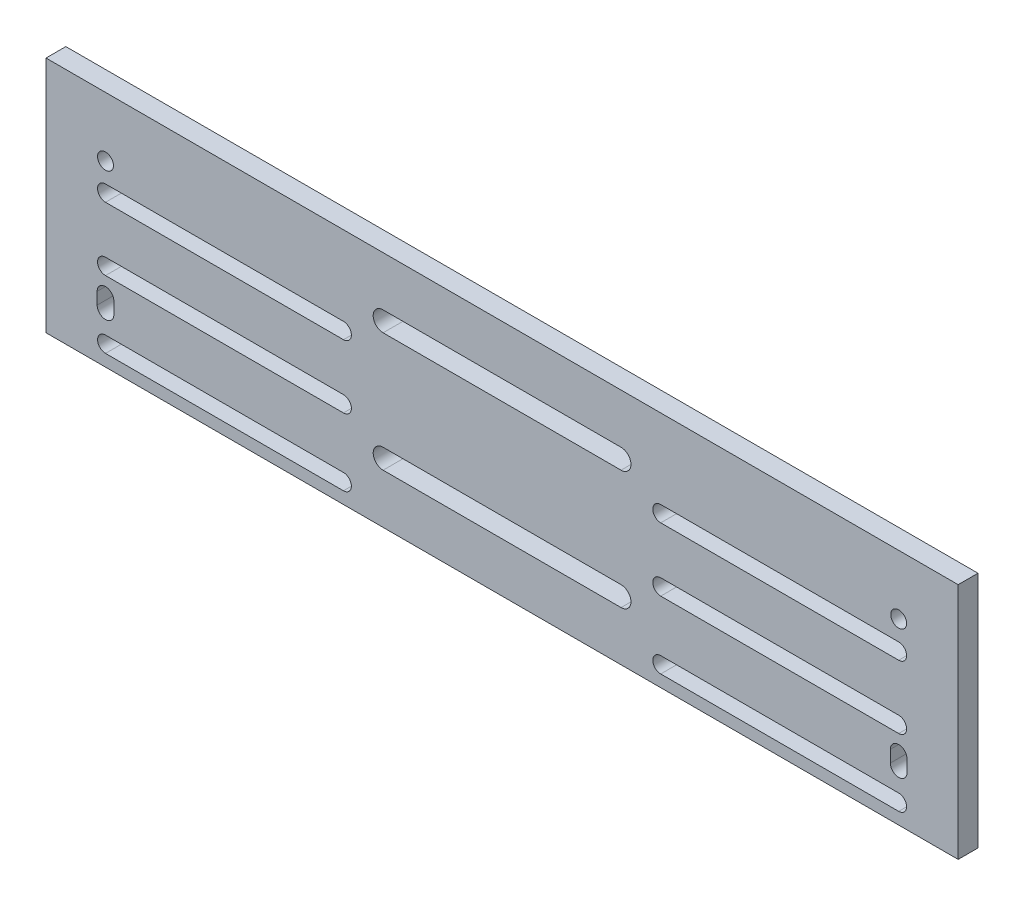
from build123d import *

# Parameters (mm, degrees)
SKETCH_2_W      = 230
SKETCH_2_H      = 60
SKETCH_2_R      = 2
EXTRUDE_1_DEPTH = 5


with BuildPart() as part:
    # 草图2 → 凸台-拉伸1 (new body)
    with BuildSketch(Plane.XY):
        Rectangle(SKETCH_2_W, SKETCH_2_H)
        with Locations((-100, 15)):
            Circle(SKETCH_2_R, mode=Mode.SUBTRACT)
        with Locations((100, 15)):
            Circle(SKETCH_2_R, mode=Mode.SUBTRACT)
        with BuildLine():
            Line((-30, 17.5), (30, 17.5))
            ThreePointArc((30, 17.5), (32.5, 15), (30, 12.5))
            Line((30, 12.5), (-30, 12.5))
            ThreePointArc((-30, 12.5), (-32.5, 15), (-30, 17.5))
        make_face(mode=Mode.SUBTRACT)
        with BuildLine():
            Line((40, -23), (100, -23))
            ThreePointArc((100, -23), (102, -25), (100, -27))
            Line((100, -27), (40, -27))
            ThreePointArc((40, -27), (38, -25), (40, -23))
        make_face(mode=Mode.SUBTRACT)
        with BuildLine():
            Line((-100, 10), (-40, 10))
            ThreePointArc((-40, 10), (-38, 8), (-40, 6))
            Line((-40, 6), (-100, 6))
            ThreePointArc((-100, 6), (-102, 8), (-100, 10))
        make_face(mode=Mode.SUBTRACT)
        with BuildLine():
            Line((-100, -10), (-40, -10))
            ThreePointArc((-40, -10), (-38, -8), (-40, -6))
            Line((-40, -6), (-100, -6))
            ThreePointArc((-100, -6), (-102, -8), (-100, -10))
        make_face(mode=Mode.SUBTRACT)
        with BuildLine():
            Line((100, -10), (40, -10))
            ThreePointArc((40, -10), (38, -8), (40, -6))
            Line((40, -6), (100, -6))
            ThreePointArc((100, -6), (102, -8), (100, -10))
        make_face(mode=Mode.SUBTRACT)
        with BuildLine():
            Line((100, 10), (40, 10))
            ThreePointArc((40, 10), (38, 8), (40, 6))
            Line((40, 6), (100, 6))
            ThreePointArc((100, 6), (102, 8), (100, 10))
        make_face(mode=Mode.SUBTRACT)
        with BuildLine():
            Line((-102.1, -17.5), (-102.1, -14.5))
            ThreePointArc((-102.1, -14.5), (-100, -12.4), (-97.9, -14.5))
            Line((-97.9, -14.5), (-97.9, -17.5))
            ThreePointArc((-97.9, -17.5), (-100, -19.6), (-102.1, -17.5))
        make_face(mode=Mode.SUBTRACT)
        with BuildLine():
            Line((102.1, -17.5), (102.1, -14.5))
            ThreePointArc((102.1, -14.5), (100, -12.4), (97.9, -14.5))
            Line((97.9, -14.5), (97.9, -17.5))
            ThreePointArc((97.9, -17.5), (100, -19.6), (102.1, -17.5))
        make_face(mode=Mode.SUBTRACT)
        with BuildLine():
            Line((-30, -17.5), (30, -17.5))
            ThreePointArc((30, -17.5), (32.5, -15), (30, -12.5))
            Line((30, -12.5), (-30, -12.5))
            ThreePointArc((-30, -12.5), (-32.5, -15), (-30, -17.5))
        make_face(mode=Mode.SUBTRACT)
        with BuildLine():
            Line((-40, -23), (-100, -23))
            ThreePointArc((-100, -23), (-102, -25), (-100, -27))
            Line((-100, -27), (-40, -27))
            ThreePointArc((-40, -27), (-38, -25), (-40, -23))
        make_face(mode=Mode.SUBTRACT)
    extrude(amount=EXTRUDE_1_DEPTH)


solid = part.part
